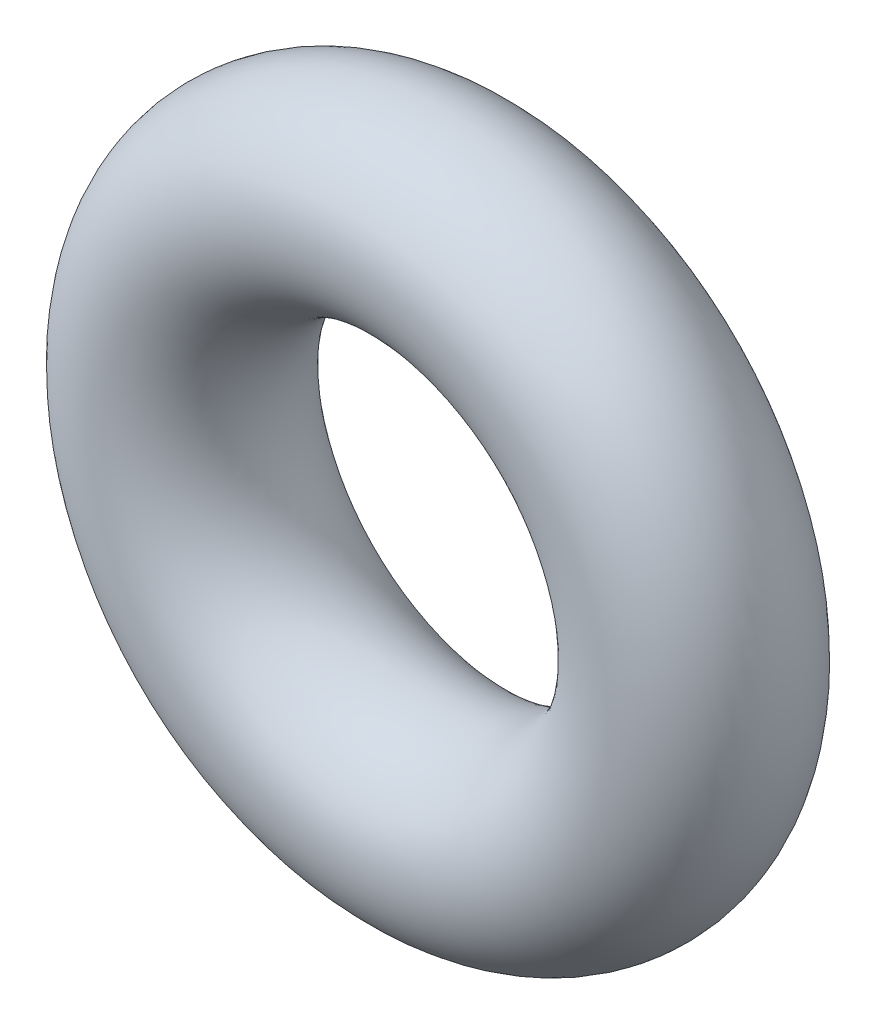
from build123d import *

# Parameters (mm, degrees)
SKETCH1_R = 0.75


with BuildPart() as part:
    # Sketch1 → Revolve1 (revolve)
    with BuildSketch(Plane(origin=(0, 0, 0), x_dir=(0, -1, 0), z_dir=(1, 0, 0)), mode=Mode.PRIVATE) as revolve1_sk:
        with Locations((2, 0)):
            Circle(SKETCH1_R)
    revolve(revolve1_sk.sketch.rotate(Axis((0, 0, 0.75), (0, 0, -1)), 270), axis=Axis((0, 0, 0.75), (0, 0, -1)))


solid = part.part
